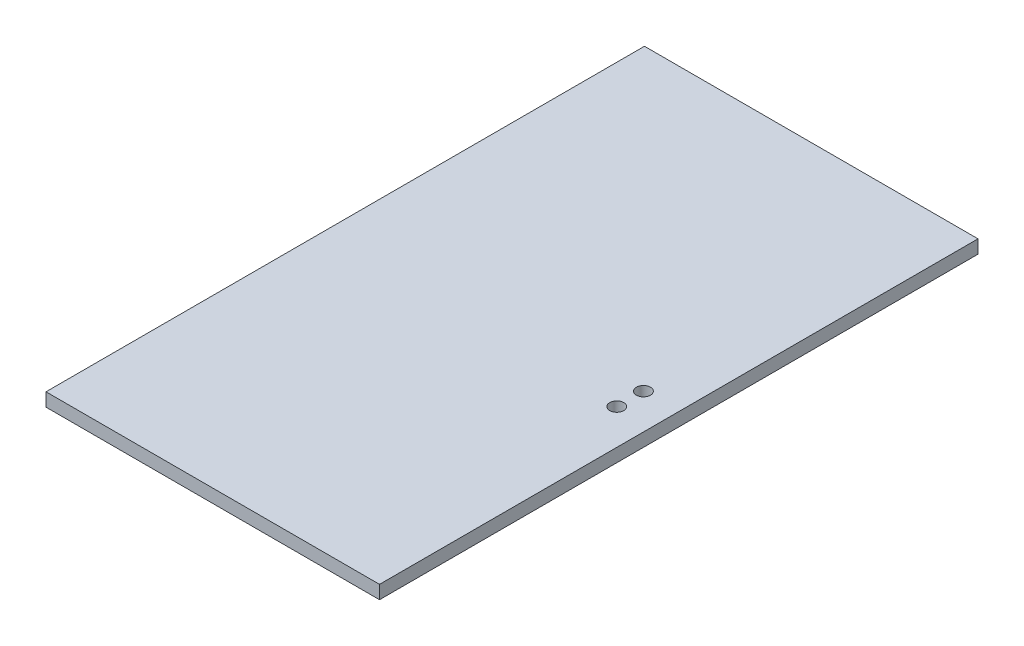
from build123d import *

# Parameters (mm, degrees)
SKETCH1_W           = 134.58
SKETCH1_H           = 3
BOSS_EXTRUDE1_DEPTH = 75
SKETCH2_W           = 3
SKETCH2_H           = 35
BOSS_EXTRUDE2_DEPTH = 9
SKETCH3_R           = 1.575
CUT_EXTRUDE1_DEPTH  = 155.330089095
SKETCH5_R           = 1.575
CUT_EXTRUDE2_DEPTH  = 155.534062265


with BuildPart() as part:
    # Sketch1 → Boss-Extrude1 (new body)
    with BuildSketch(Plane(origin=(0, 0, 0), x_dir=(0, 0, -1), z_dir=(1, 0, 0))):
        with Locations((67.29, 1.5)):
            Rectangle(SKETCH1_W, SKETCH1_H)
    extrude(amount=BOSS_EXTRUDE1_DEPTH)

    # Sketch2 → Boss-Extrude2 (add)
    with BuildSketch(Plane.XZ):
        with Locations((1.5, -29.6)):
            Rectangle(SKETCH2_W, SKETCH2_H)
    extrude(amount=BOSS_EXTRUDE2_DEPTH)

    # Sketch3 → Cut-Extrude1 (cut, through all)
    with BuildSketch(Plane.ZY):
        with Locations((-23.766666667, -4.5)):
            Circle(SKETCH3_R)
        with Locations((-35.433333333, -4.5)):
            Circle(SKETCH3_R)
    extrude(amount=-CUT_EXTRUDE1_DEPTH, mode=Mode.SUBTRACT)

    # Sketch5 → Cut-Extrude2 (cut, through all)
    with BuildSketch(Plane(origin=(0, 3, 0), x_dir=(1, 0, 0), z_dir=(0, 1, 0))):
        with Locations(Location((67.059177496, 61.29, 0), (0, 0, 270))):
            Circle(SKETCH5_R)
        with Locations(Location((67.059177496, 67.29, 0), (0, 0, 270))):
            Circle(SKETCH5_R)
    extrude(amount=-CUT_EXTRUDE2_DEPTH, mode=Mode.SUBTRACT)


solid = part.part
